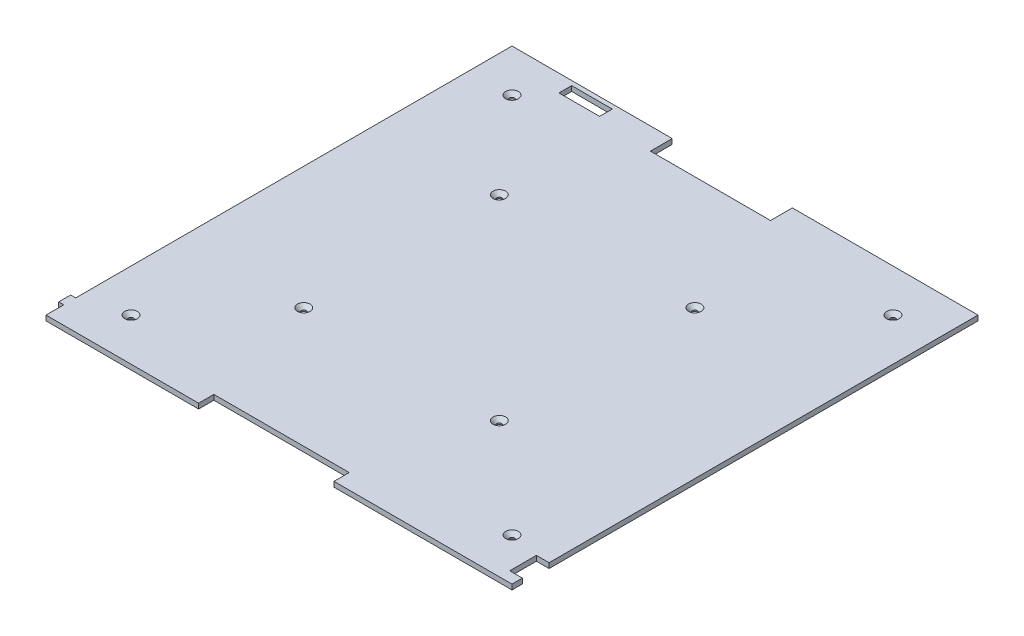
from build123d import *

# Parameters (mm, degrees)
BOSS_EXTRUDE1_DEPTH = 2
SKETCH2_R           = 1
CUT_EXTRUDE1_DEPTH  = 132.191177295
CHAMFER1_SIZE       = 1.5
SKETCH3_W           = 16
SKETCH3_H           = 5
CUT_EXTRUDE2_DEPTH  = 132.191177295


with BuildPart() as part:
    # Sketch1 → Boss-Extrude1 (new body)
    with BuildSketch(Plane(origin=(0, 0, 0), x_dir=(1, 0, 0), z_dir=(0, 1, 0))):
        Polygon((-91.75, 91.75), (-91.75, -80.05), (-93.75, -80.05), (-93.75, -84.75), (-91.75, -84.75), (-91.75, -91.75), (-31.65, -91.75), (-31.65, -85.75), (21.65, -85.75), (21.65, -91.75), (91.75, -91.75), (91.75, -87.65), (86.75, -87.65), (86.75, -77.15), (91.75, -77.15), (91.75, 91.75), (18.65, 91.75), (18.65, 83.15), (-28.65, 83.15), (-28.65, 91.75), align=None)
    extrude(amount=BOSS_EXTRUDE1_DEPTH)

    # Sketch2 → Cut-Extrude1 (cut, through all)
    with BuildSketch(Plane.XZ):
        with Locations(Location((75, -75, 0), (0, 0, 270))):
            Circle(SKETCH2_R)
        with Locations(Location((-75, -75, 0), (0, 0, 270))):
            Circle(SKETCH2_R)
        with Locations(Location((-75, 75, 0), (0, 0, 270))):
            Circle(SKETCH2_R)
        with Locations(Location((75, 75, 0), (0, 0, 270))):
            Circle(SKETCH2_R)
        with Locations(Location((33.5, -38.5, 0), (0, 0, 270))):
            Circle(SKETCH2_R)
        with Locations(Location((33.5, 38.5, 0), (0, 0, 270))):
            Circle(SKETCH2_R)
        with Locations(Location((-43.5, -38.5, 0), (0, 0, 270))):
            Circle(SKETCH2_R)
        with Locations(Location((-43.5, 38.5, 0), (0, 0, 270))):
            Circle(SKETCH2_R)
    extrude(amount=-CUT_EXTRUDE1_DEPTH, mode=Mode.SUBTRACT)

    # Chamfer1
    chamfer1_edges = [part.edges().sort_by_distance(p)[0] for p in [
        (-75, 2, -74),
        (-75, 2, 76),
        (75, 2, 76),
        (33.5, 2, -37.5),
        (-43.5, 2, 39.5),
        (-43.5, 2, -37.5),
        (33.5, 2, 39.5),
        (75, 2, -74),
    ]]
    chamfer(chamfer1_edges, length=CHAMFER1_SIZE)

    # Sketch3 → Cut-Extrude2 (cut, through all)
    with BuildSketch(Plane.XZ):
        with Locations((-58.5, -87.5)):
            Rectangle(SKETCH3_W, SKETCH3_H)
    extrude(amount=-CUT_EXTRUDE2_DEPTH, mode=Mode.SUBTRACT)


solid = part.part
